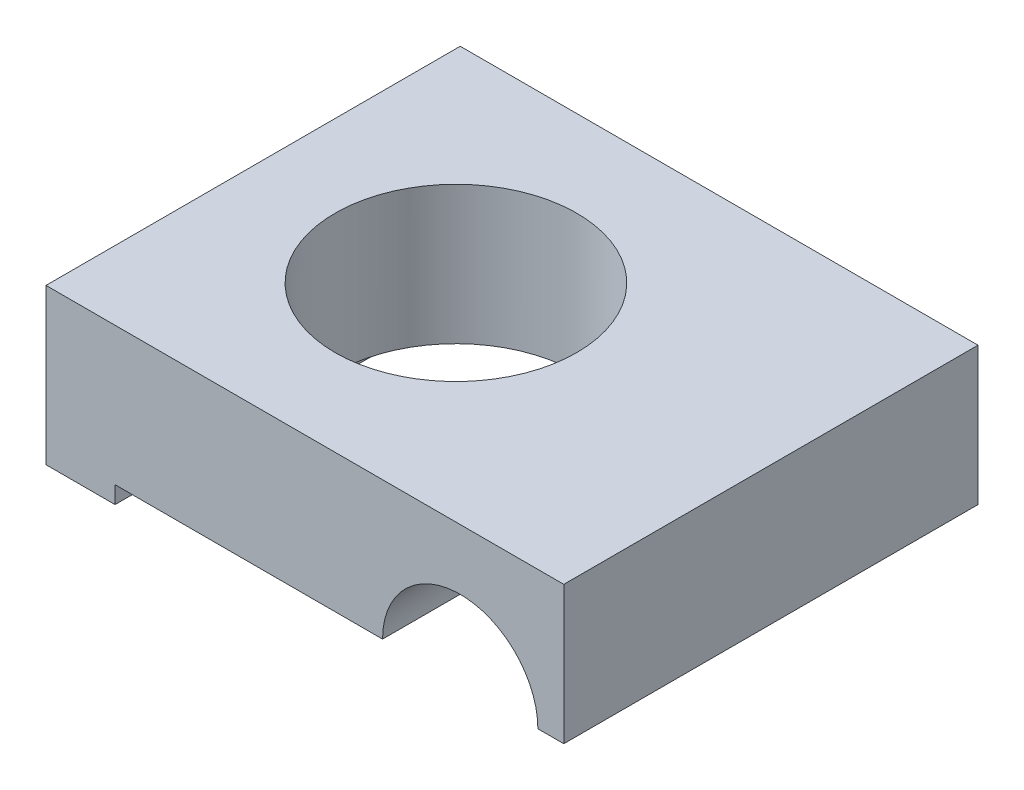
from build123d import *

# Parameters (mm, degrees)
EXTRUS_O1_DEPTH       = 6
ESBO_O2_R             = 3.5
CORTE_EXTRUS_O1_DEPTH = 12


with BuildPart() as part:
    # Esboço1 → Extrusão1 (new, symmetric)
    with BuildSketch(Plane.XY):
        with BuildLine():
            Line((-10, -0.5), (-10, 0))
            Line((-10, 0), (-2.25, 0))
            ThreePointArc((-2.25, 0), (0, 2.25), (2.25, 0))
            Line((2.25, 0), (3, 0))
            Line((3, 0), (3, 4))
            Line((3, 4), (-12, 4))
            Line((-12, 4), (-12, -0.5))
            Line((-12, -0.5), (-10, -0.5))
        make_face()
    extrude(amount=EXTRUS_O1_DEPTH, both=True)

    # Esboço2 → Corte-extrusão1 (cut)
    with BuildSketch(Plane.XZ):
        with Locations((-6.125, 0)):
            Circle(ESBO_O2_R)
    extrude(amount=-CORTE_EXTRUS_O1_DEPTH, mode=Mode.SUBTRACT)


solid = part.part
